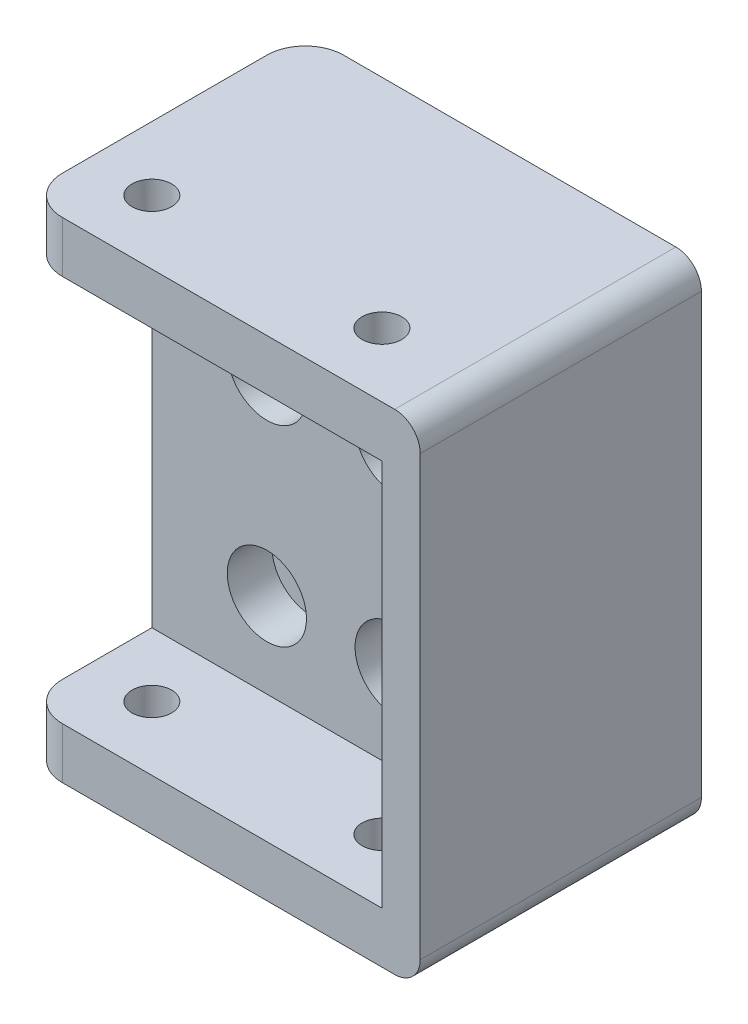
from build123d import *

# Parameters (mm, degrees)
SKETCH_1_W               = 28
SKETCH_1_H               = 20.3
SKETCH_1_R               = 1.5
EXTRUDE_1_DEPTH          = 5
SKETCH_2_W               = 28
SKETCH_2_H               = 6
SKETCH_2_H_2             = 4
EXTRUDE_2_DEPTH          = 10
SKETCH_3_W               = 28
SKETCH_3_H               = 6
EXTRUDE_3_DEPTH          = 5
SKETCH_4_R               = 1.5
CUT_EXTRUDE_1_DEPTH      = 27.11173108
SKETCH_5_W               = 10
SKETCH_5_H               = 6
SKETCH_5_W_2             = 5
SKETCH_5_H_2             = 4
CUT_EXTRUDE_2_DEPTH      = 34.835225727
SKETCH_6_W               = 28
SKETCH_6_H               = 30.3
CUT_EXTRUDE_3_DEPTH      = 1
EXTRUDE_4_DEPTH          = 12
EXTRUDE_4_DEPTH_BACK     = 10
SKETCH_7_W               = 28
SKETCH_7_H               = 4
CUT_EXTRUDE_4_DEPTH      = 28.313412456
CUT_EXTRUDE_4_DEPTH_BACK = 1.5
SKETCH_9_R               = 3.1
SKETCH_9_R_2             = 1.5
CUT_EXTRUDE_5_DEPTH      = 41.354553646
CUT_EXTRUDE_5_DEPTH_BACK = 41.354553646
SKETCH_10_R              = 1.55
SKETCH_11_W              = 12
SKETCH_11_H              = 30.3
SKETCH_11_W_2            = 6
EXTRUDE_5_DEPTH          = 3
FILLET_1_R               = 2
FILLET_2_R               = 3
EXTRUDE_START            = 2
SKETCH_13_W              = 28
SKETCH_13_H              = 30.3
SKETCH_13_R              = 3.1
EXTRUDE_6_DEPTH          = 2


with BuildPart() as part:
    # 草图1 → 凸台-拉伸1 (new body)
    with BuildSketch(Plane.XY):
        Rectangle(SKETCH_1_W, SKETCH_1_H)
        with Locations((-5, 7.5)):
            Circle(SKETCH_1_R, mode=Mode.SUBTRACT)
        with Locations((5, 7.5)):
            Circle(SKETCH_1_R, mode=Mode.SUBTRACT)
        with Locations((5, -7.5)):
            Circle(SKETCH_1_R, mode=Mode.SUBTRACT)
        with Locations((-5, -7.5)):
            Circle(SKETCH_1_R, mode=Mode.SUBTRACT)
    extrude(amount=EXTRUDE_1_DEPTH)

    # 草图2 → 凸台-拉伸2 (add)
    with BuildSketch(Plane.XY.offset(5)):
        with Locations((0, 13.15)):
            Rectangle(SKETCH_2_W, SKETCH_2_H)
        with Locations((0, -12.15)):
            Rectangle(SKETCH_2_W, SKETCH_2_H_2)
    extrude(amount=-EXTRUDE_2_DEPTH)

    # 草图3 → 凸台-拉伸3 (add)
    with BuildSketch(Plane(origin=(0, 0, -5), x_dir=(-1, 0, 0), z_dir=(0, 0, -1))):
        with Locations((0, 13.15)):
            Rectangle(SKETCH_3_W, SKETCH_3_H)
    extrude(amount=EXTRUDE_3_DEPTH)

    # 草图4 → 切除-拉伸1 (cut, through all)
    with BuildSketch(Plane.XY.offset(5)):
        with Locations((-9, 13.15)):
            Circle(SKETCH_4_R)
        with Locations((9, 13.15)):
            Circle(SKETCH_4_R)
    extrude(amount=-CUT_EXTRUDE_1_DEPTH, mode=Mode.SUBTRACT)

    # 草图5 → 切除-拉伸2 (cut, through all)
    with BuildSketch(Plane.ZY.offset(14)):
        with Locations((-5, 13.15)):
            Rectangle(SKETCH_5_W, SKETCH_5_H)
        with Locations((-2.5, -12.15)):
            Rectangle(SKETCH_5_W_2, SKETCH_5_H_2)
    extrude(amount=-CUT_EXTRUDE_2_DEPTH, mode=Mode.SUBTRACT)

    # 草图6 → 切除-拉伸3 (cut)
    with BuildSketch(Plane.XY.offset(5)):
        with Locations((0, 1)):
            Rectangle(SKETCH_6_W, SKETCH_6_H)
    extrude(amount=-CUT_EXTRUDE_3_DEPTH, mode=Mode.SUBTRACT)

    # 草图7 → 凸台-拉伸4 (add, two sides: drawn at the far end of the back side and taken through both)
    with BuildSketch(Plane.XY.offset(4).offset(-EXTRUDE_4_DEPTH_BACK)):
        with Locations((0, 18.15)):
            Rectangle(SKETCH_7_W, SKETCH_7_H)
        with Locations((0, -16.15)):
            Rectangle(SKETCH_7_W, SKETCH_7_H)
    extrude(amount=EXTRUDE_4_DEPTH + EXTRUDE_4_DEPTH_BACK)

    # 草图9 → 切除-拉伸4 (cut, two sides: drawn at the far end of the back side and taken through both)
    # profile 1 of 6: a face of its own
    with BuildSketch(Plane.XY.offset(4).offset(-CUT_EXTRUDE_4_DEPTH_BACK)):
        with Locations((-5, 7.5)):
            Circle(SKETCH_9_R)
        with Locations((-5, 7.5)):
            Circle(SKETCH_9_R_2, mode=Mode.SUBTRACT)
    # profile 2 of 6: a face of its own
    with BuildSketch(Plane.XY.offset(4).offset(-CUT_EXTRUDE_4_DEPTH_BACK)):
        with Locations((5, 7.5)):
            Circle(SKETCH_9_R)
        with Locations((5, 7.5)):
            Circle(SKETCH_9_R_2, mode=Mode.SUBTRACT)
    # profile 3 of 6: a face of its own
    with BuildSketch(Plane.XY.offset(4).offset(-CUT_EXTRUDE_4_DEPTH_BACK)):
        with Locations((5, -7.5)):
            Circle(SKETCH_9_R)
        with Locations((5, -7.5)):
            Circle(SKETCH_9_R_2, mode=Mode.SUBTRACT)
    # profile 4 of 6: a face of its own
    with BuildSketch(Plane.XY.offset(4).offset(-CUT_EXTRUDE_4_DEPTH_BACK)):
        with Locations((-5, -7.5)):
            Circle(SKETCH_9_R)
        with Locations((-5, -7.5)):
            Circle(SKETCH_9_R_2, mode=Mode.SUBTRACT)
    # profile 5 of 6: a face of its own
    with BuildSketch(Plane.XY.offset(4).offset(-CUT_EXTRUDE_4_DEPTH_BACK)):
        Polygon((-7.36898549, 10.325), (-5.737970979, 13.15), (-7.36898549, 15.975), (-10.63101451, 15.975), (-12.262029021, 13.15), (-10.63101451, 10.325), align=None)
        with Locations((-9, 13.15)):
            Circle(SKETCH_9_R_2, mode=Mode.SUBTRACT)
    # profile 6 of 6: a face of its own
    with BuildSketch(Plane.XY.offset(4).offset(-CUT_EXTRUDE_4_DEPTH_BACK)):
        Polygon((10.63101451, 10.325), (12.262029021, 13.15), (10.63101451, 15.975), (7.36898549, 15.975), (5.737970979, 13.15), (7.36898549, 10.325), align=None)
        with Locations((9, 13.15)):
            Circle(SKETCH_9_R_2, mode=Mode.SUBTRACT)
    extrude(amount=CUT_EXTRUDE_4_DEPTH + CUT_EXTRUDE_4_DEPTH_BACK, mode=Mode.SUBTRACT)

    # 草图10 → 切除-拉伸5 (cut, two sides: drawn at the far end of the back side and taken through both)
    with BuildSketch(Plane(origin=(0, -14.15, 0), x_dir=(1, 0, 0), z_dir=(0, 1, 0)).offset(-CUT_EXTRUDE_5_DEPTH_BACK)):
        with Locations(Location((-9, -11, 0), (0, 0, 270))):
            Circle(SKETCH_10_R)
        with Locations(Location((9, -11, 0), (0, 0, 270))):
            Circle(SKETCH_10_R)
    extrude(amount=CUT_EXTRUDE_5_DEPTH + CUT_EXTRUDE_5_DEPTH_BACK, mode=Mode.SUBTRACT)

    # 草图11 → 凸台-拉伸5 (add)
    with BuildSketch(Plane(origin=(14, 0, 0), x_dir=(0, 0, -1), z_dir=(1, 0, 0))):
        Polygon((-16, 16.15), (-4, 16.15), (-4, -14.15), (-16, -14.15), (-16, -18.15), (6, -18.15), (6, -14.15), (0, -14.15), (0, 16.15), (6, 16.15), (6, 20.15), (-16, 20.15), align=None)
        with Locations((-10, 1)):
            Rectangle(SKETCH_11_W, SKETCH_11_H)
        with Locations((3, 1)):
            Rectangle(SKETCH_11_W_2, SKETCH_11_H)
    extrude(amount=EXTRUDE_5_DEPTH)

    # 圆角1
    fillet_1_edges = [part.edges().sort_by_distance(p)[0] for p in [
        (17, 20.15, 5),
        (17, -18.15, 5),
    ]]
    fillet(fillet_1_edges, radius=FILLET_1_R)

    # 圆角2
    fillet_2_edges = [part.edges().sort_by_distance(p)[0] for p in [
        (-14, 18.15, 16),
        (-14, 18.15, -6),
        (-14, -16.15, -6),
        (-14, -16.15, 16),
    ]]
    fillet(fillet_2_edges, radius=FILLET_2_R)

    # 草图13 → 凸台-拉伸6 (add)
    with BuildSketch(Plane.XY.offset(4).offset(EXTRUDE_START)):
        with Locations((0, 1)):
            Rectangle(SKETCH_13_W, SKETCH_13_H)
        with Locations((5, -7.5)):
            Circle(SKETCH_13_R, mode=Mode.SUBTRACT)
        with Locations((-5, -7.5)):
            Circle(SKETCH_13_R, mode=Mode.SUBTRACT)
        with Locations((5, 7.5)):
            Circle(SKETCH_13_R, mode=Mode.SUBTRACT)
        with Locations((-5, 7.5)):
            Circle(SKETCH_13_R, mode=Mode.SUBTRACT)
        Polygon((-10.63101451, 15.975), (-7.36898549, 15.975), (-5.737970979, 13.15), (-7.36898549, 10.325), (-10.63101451, 10.325), (-12.262029021, 13.15), align=None, mode=Mode.SUBTRACT)
        Polygon((10.63101451, 10.325), (7.36898549, 10.325), (5.737970979, 13.15), (7.36898549, 15.975), (10.63101451, 15.975), (12.262029021, 13.15), align=None, mode=Mode.SUBTRACT)
    extrude(amount=-EXTRUDE_6_DEPTH)


solid = part.part
